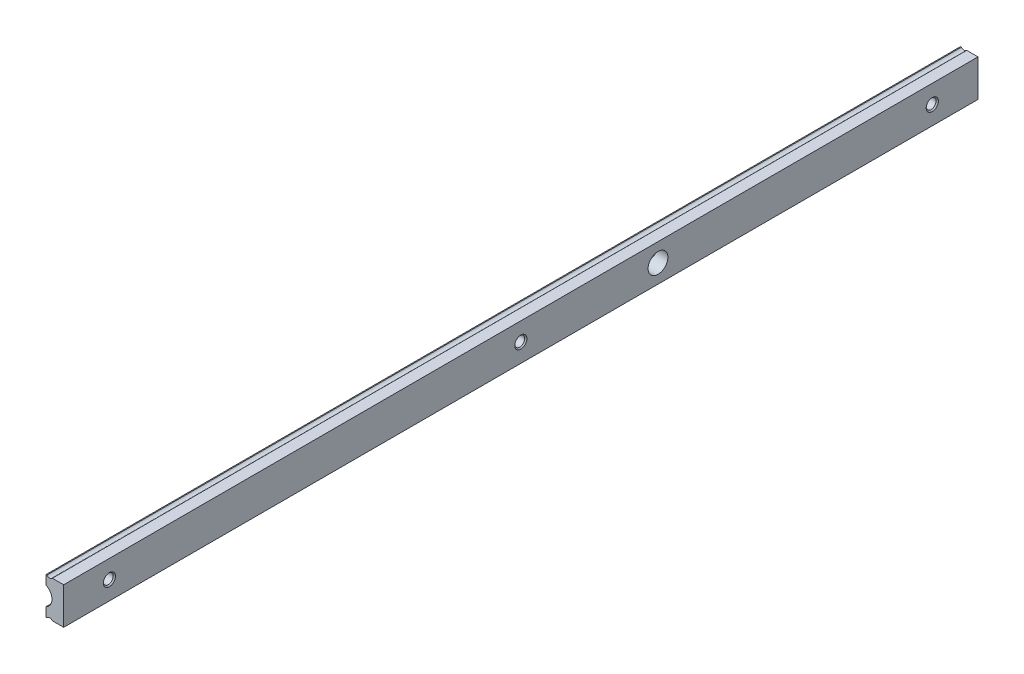
from build123d import *

# Parameters (mm, degrees)
BOSS_EXTRUDE1_DEPTH = 300
SKETCH5_R           = 3.25
CUT_EXTRUDE1_DEPTH  = 6


with BuildPart() as part:
    # Sketch1 → Boss-Extrude1 (new body)
    with BuildSketch(Plane.XY):
        with BuildLine():
            Line((0, 2.974695137), (0, 0))
            Line((0, 0), (0.305572809, 0))
            ThreePointArc((0.305572809, 0), (1.2, 0.4), (2.094427191, 0))
            Line((2.094427191, 0), (5.8, 0))
            Line((5.8, 0), (5.8, 12.1))
            Line((5.8, 12.1), (2.094427191, 12.1))
            ThreePointArc((2.094427191, 12.1), (1.2, 11.7), (0.305572809, 12.1))
            Line((0.305572809, 12.1), (0, 12.1))
            Line((0, 12.1), (0, 9.125304863))
            ThreePointArc((0, 9.125304863), (1.95, 6.05), (0, 2.974695137))
        make_face()
    extrude(amount=BOSS_EXTRUDE1_DEPTH)

    # Sketch2 → Cut-Revolve1 (revolve, cut)
    with BuildSketch(Plane.XY.offset(15), mode=Mode.PRIVATE) as cut_revolve1_sk:
        Polygon((1.299545417, 6.05), (1.299545417, 8.05), (1.678545417, 7.671), (5.421, 7.671), (5.8, 8.05), (5.8, 6.05), align=None)
    revolve(cut_revolve1_sk.sketch.rotate(Axis((5.8, 6.05, 15), (-1, 0, 0)), 270), axis=Axis((5.8, 6.05, 15), (-1, 0, 0)), mode=Mode.SUBTRACT)

    # Sketch3 → Cut-Revolve2 (revolve, cut)
    with BuildSketch(Plane.XY.offset(285), mode=Mode.PRIVATE) as cut_revolve2_sk:
        Polygon((1.299545417, 6.05), (1.299545417, 8.05), (1.678545417, 7.671), (5.421, 7.671), (5.8, 8.05), (5.8, 6.05), align=None)
    revolve(cut_revolve2_sk.sketch.rotate(Axis((5.8, 6.05, 285), (-1, 0, 0)), 270), axis=Axis((5.8, 6.05, 285), (-1, 0, 0)), mode=Mode.SUBTRACT)

    # Sketch4 → Cut-Revolve3 (revolve, cut)
    with BuildSketch(Plane.XY.offset(150), mode=Mode.PRIVATE) as cut_revolve3_sk:
        Polygon((1.299545417, 6.05), (1.299545417, 8.05), (1.678545417, 7.671), (5.421, 7.671), (5.8, 8.05), (5.8, 6.05), align=None)
    revolve(cut_revolve3_sk.sketch.rotate(Axis((5.8, 6.05, 150), (-1, 0, 0)), 270), axis=Axis((5.8, 6.05, 150), (-1, 0, 0)), mode=Mode.SUBTRACT)

    # Sketch5 → Cut-Extrude1 (cut)
    with BuildSketch(Plane(origin=(5.8, 0, 0), x_dir=(0, 0, -1), z_dir=(1, 0, 0))):
        with Locations((-105, 6.05)):
            Circle(SKETCH5_R)
    extrude(amount=-CUT_EXTRUDE1_DEPTH, mode=Mode.SUBTRACT)


solid = part.part
